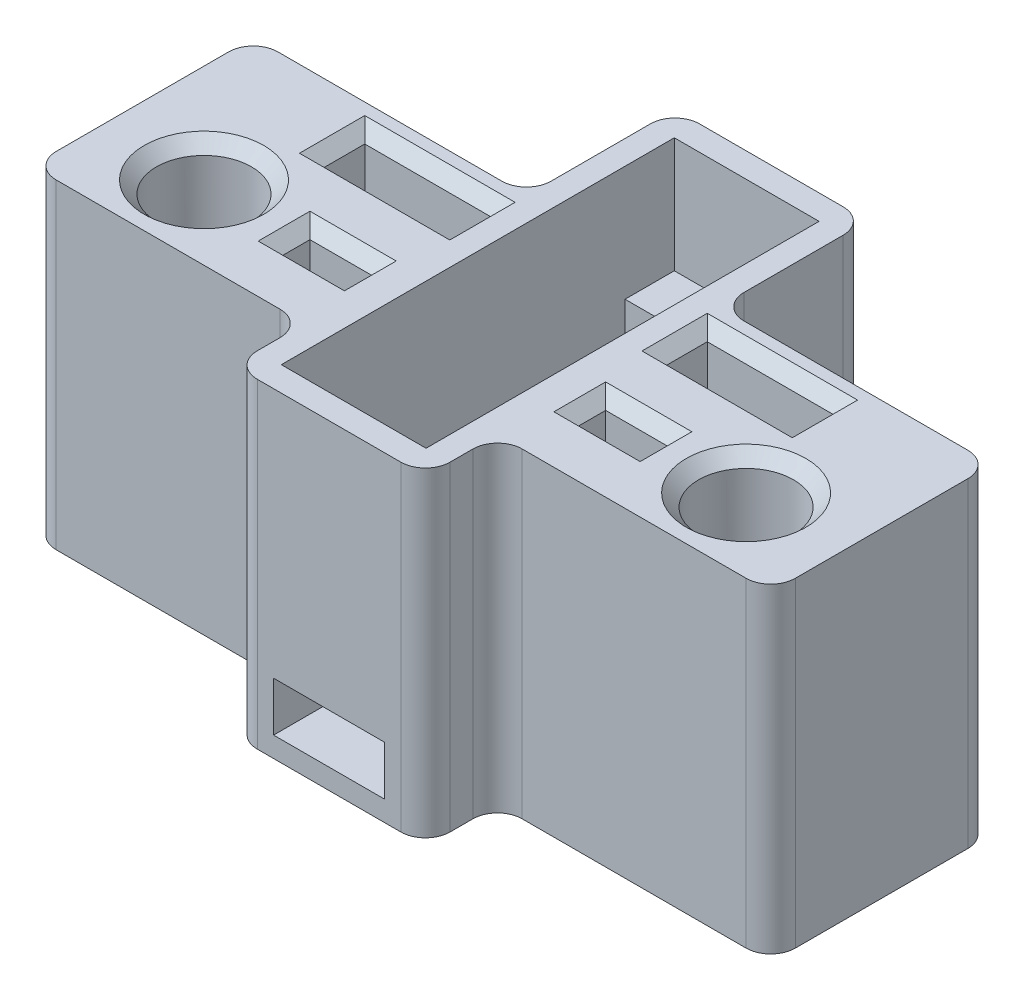
from build123d import *

# Parameters (mm, degrees)
SKETCH1_W             = 60
SKETCH1_H             = 18
BOSS_EXTRUDE1_DEPTH   = 26
SKETCH2_R             = 3.85
EYESHAFT_HOLES_DEPTH  = 15
EYESHAFT_FILLET_R     = 3
SKETCH5_W             = 5
SKETCH5_H             = 2.2
FRONT_LEG_HOLES_DEPTH = 13
SKETCH7_W             = 10.2
SKETCH7_H             = 3.3
BACK_LEGS_DEPTH       = 13
SKETCH18_W            = 15.65
SKETCH18_H            = 35.9
BOSS_EXTRUDE2_DEPTH   = 26
SKETCH19_W            = 11.75
SKETCH19_H            = 31.9
CUT_EXTRUDE9_DEPTH    = 9.35
SKETCH20_W            = 11.75
SKETCH20_H            = 23.9
CUT_EXTRUDE10_DEPTH   = 15
FILLET4_R             = 2
CHAMFER1_SIZE         = 1
SKETCH21_W            = 9
SKETCH21_H            = 4
CUT_EXTRUDE11_DEPTH   = 15
FILLET5_R             = 2
SKETCH22_R            = 0.75
CUT_EXTRUDE12_DEPTH   = 3


with BuildPart() as part:
    # Sketch1 → Boss-Extrude1 (new body)
    with BuildSketch(Plane(origin=(0, 0, 0), x_dir=(1, 0, 0), z_dir=(0, 1, 0))):
        Rectangle(SKETCH1_W, SKETCH1_H)
    extrude(amount=BOSS_EXTRUDE1_DEPTH)

    # Sketch2 → Eyeshaft holes (cut)
    with BuildSketch(Plane(origin=(0, 26, 0), x_dir=(1, 0, 0), z_dir=(0, 1, 0))):
        with Locations(Location((-22, -3, 0), (0, 0, 270))):
            Circle(SKETCH2_R)
        with Locations(Location((22, -3, 0), (0, 0, 270))):
            Circle(SKETCH2_R)
    extrude(amount=-EYESHAFT_HOLES_DEPTH, mode=Mode.SUBTRACT)

    # Eyeshaft Fillet
    eyeshaft_fillet_edges = [part.edges().sort_by_distance(p)[0] for p in [
        (-22, 11, -0.85),
        (22, 11, -0.85),
    ]]
    fillet(eyeshaft_fillet_edges, radius=EYESHAFT_FILLET_R)

    # Sketch5 → Front leg holes (cut)
    with BuildSketch(Plane(origin=(0, 26, 0), x_dir=(1, 0, 0), z_dir=(0, 1, 0))):
        with Locations((-12, -3)):
            Rectangle(SKETCH5_W, SKETCH5_H)
        with Locations((12, -3)):
            Rectangle(SKETCH5_W, SKETCH5_H)
    extrude(amount=-FRONT_LEG_HOLES_DEPTH, mode=Mode.SUBTRACT)

    # Sketch7 → Back Legs (cut)
    with BuildSketch(Plane(origin=(0, 26, 0), x_dir=(1, 0, 0), z_dir=(0, 1, 0))):
        with Locations((-13.9, 5.4)):
            Rectangle(SKETCH7_W, SKETCH7_H)
        with Locations((13.9, 5.4)):
            Rectangle(SKETCH7_W, SKETCH7_H)
    extrude(amount=-BACK_LEGS_DEPTH, mode=Mode.SUBTRACT)

    # Sketch18 → Boss-Extrude2 (add)
    with BuildSketch(Plane(origin=(0, 26, 0), x_dir=(1, 0, 0), z_dir=(0, 1, 0))):
        with Locations((0, 3.1)):
            Rectangle(SKETCH18_W, SKETCH18_H)
    extrude(amount=-BOSS_EXTRUDE2_DEPTH)

    # Sketch19 → Cut-Extrude9 (cut)
    with BuildSketch(Plane(origin=(0, 26, 0), x_dir=(1, 0, 0), z_dir=(0, 1, 0))):
        with Locations((0, 3.1)):
            Rectangle(SKETCH19_W, SKETCH19_H)
    extrude(amount=-CUT_EXTRUDE9_DEPTH, mode=Mode.SUBTRACT)

    # Sketch20 → Cut-Extrude10 (cut)
    with BuildSketch(Plane(origin=(0, 16.65, 0), x_dir=(1, 0, 0), z_dir=(0, 1, 0))):
        with Locations((0, 3.1)):
            Rectangle(SKETCH20_W, SKETCH20_H)
    extrude(amount=-CUT_EXTRUDE10_DEPTH, mode=Mode.SUBTRACT)

    # Fillet4
    fillet4_edges = [part.edges().sort_by_distance(p)[0] for p in [
        (30, 13, 9),
        (-30, 13, 9),
        (-30, 13, -9),
        (30, 13, -9),
        (-7.825, 13, 14.85),
        (7.825, 13, -21.05),
        (-7.825, 13, -21.05),
        (-7.825, 13, -9),
        (-7.825, 13, 9),
        (7.825, 13, 14.85),
        (7.825, 13, -9),
        (7.825, 13, 9),
    ]]
    fillet(fillet4_edges, radius=FILLET4_R)

    # Chamfer1
    chamfer1_edges = [part.edges().sort_by_distance(p)[0] for p in [
        (-22, 26, -0.85),
        (22, 26, -0.85),
        (-9.5, 26, 3),
        (-12, 26, 1.9),
        (-14.5, 26, 3),
        (-12, 26, 4.1),
        (14.5, 26, 3),
        (12, 26, 1.9),
        (9.5, 26, 3),
        (12, 26, 4.1),
        (-19, 26, -5.4),
        (-13.9, 26, -3.75),
        (-8.8, 26, -5.4),
        (-13.9, 26, -7.05),
        (8.8, 26, -5.4),
        (13.9, 26, -3.75),
        (19, 26, -5.4),
        (13.9, 26, -7.05),
    ]]
    chamfer(chamfer1_edges, length=CHAMFER1_SIZE)

    # Sketch21 → Cut-Extrude11 (cut)
    with BuildSketch(Plane(origin=(0, 0, 8.85), x_dir=(-1, 0, 0), z_dir=(0, 0, -1))):
        with Locations((0, 3.65)):
            Rectangle(SKETCH21_W, SKETCH21_H)
    extrude(amount=-CUT_EXTRUDE11_DEPTH, mode=Mode.SUBTRACT)

    # Fillet5
    fillet5_edges = [part.edges().sort_by_distance(p)[0] for p in [
        (0, 5.65, 8.85),
    ]]
    fillet(fillet5_edges, radius=FILLET5_R)

    # Sketch22 → Cut-Extrude12 (cut)
    with BuildSketch(Plane(origin=(0, 16.65, 0), x_dir=(1, 0, 0), z_dir=(0, 1, 0))):
        with Locations(Location((0, 17.3, 0), (0, 0, 270))):
            Circle(SKETCH22_R)
        with Locations(Location((0, -11.1, 0), (0, 0, 270))):
            Circle(SKETCH22_R)
    extrude(amount=-CUT_EXTRUDE12_DEPTH, mode=Mode.SUBTRACT)


solid = part.part
